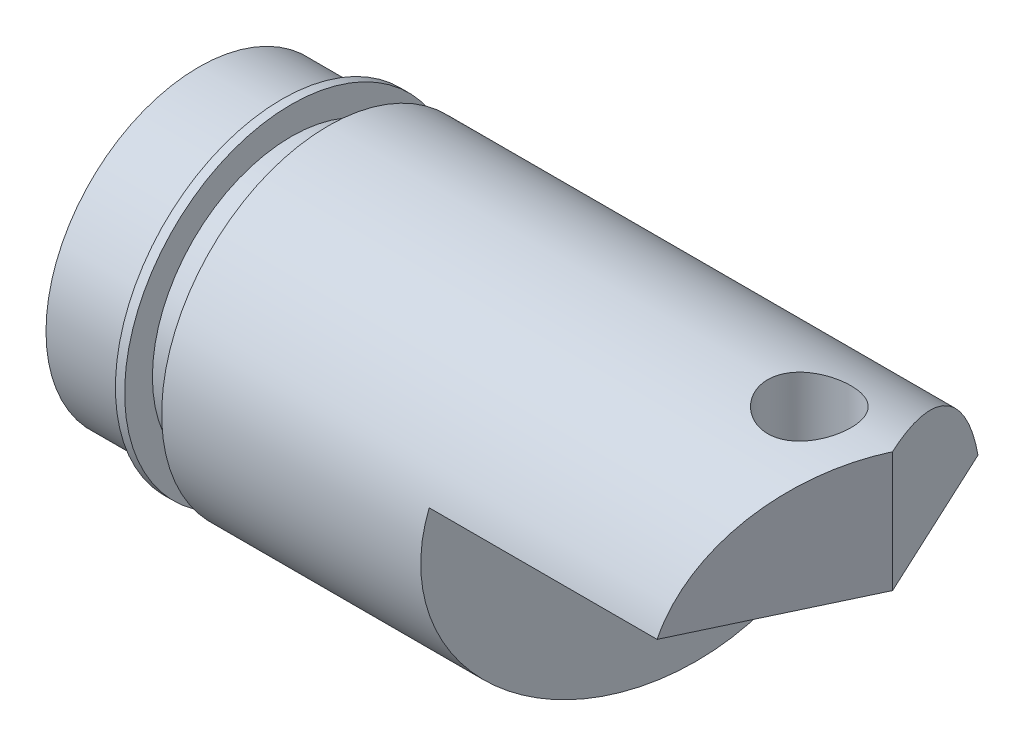
from build123d import *

# Parameters (mm, degrees)
ENL_V_MAT_EXTRU_3_DEPTH = 161.972047263
ESQUISSE8_R             = 9
ENL_V_MAT_EXTRU_4_DEPTH = 161.972047263


with BuildPart() as part:
    # Esquisse6 → Révolution1 (revolve)
    with BuildSketch(Plane.XY):
        with BuildLine():
            Line((0, 21), (0, 33))
            Line((0, 33), (18, 33))
            Line((18, 33), (18, 36))
            Line((18, 36), (20, 36))
            Line((20, 36), (20, 30))
            Line((20, 30), (28, 30))
            Line((28, 30), (28, 36))
            Line((28, 36), (150, 36))
            Line((150, 36), (150, 0))
            Line((150, 0), (80.999999995, 0))
            ThreePointArc((80.999999995, 0), (77.265560701, 9.903895293), (67.921714398, 14.876391154))
            Line((67.921714398, 14.876391154), (36, 19))
            Line((36, 19), (36, 21))
            Line((36, 21), (0, 21))
        make_face()
    revolve(axis=Axis((150, 0, 0), (-1, 0, 0)))

    # Esquisse7 → Enlèv. mat.-Extru.3 (cut, through all)
    with BuildSketch(Plane(origin=(0, 10, 0), x_dir=(1, 0, 0), z_dir=(0, 1, 0))):
        Polygon((105, 36), (84, -36), (150, -36), (150, 36), align=None)
    extrude(amount=-ENL_V_MAT_EXTRU_3_DEPTH, mode=Mode.SUBTRACT)

    # Esquisse8 → Enlèv. mat.-Extru.4 (cut, through all)
    with BuildSketch(Plane(origin=(0, 10, 0), x_dir=(-1, 0, 0), z_dir=(0, 1, 0))):
        with Locations(Location((-132, 0, 0), (0, 0, 180))):
            Circle(ESQUISSE8_R)
        Polygon((-130.288986923, -42.270403954), (-160.663521038, -42.270403954), (-160.663521038, 48.483793559), (-127.12534153, 48.483793559), (-150, 0), align=None)
    extrude(amount=ENL_V_MAT_EXTRU_4_DEPTH, mode=Mode.SUBTRACT)


solid = part.part
